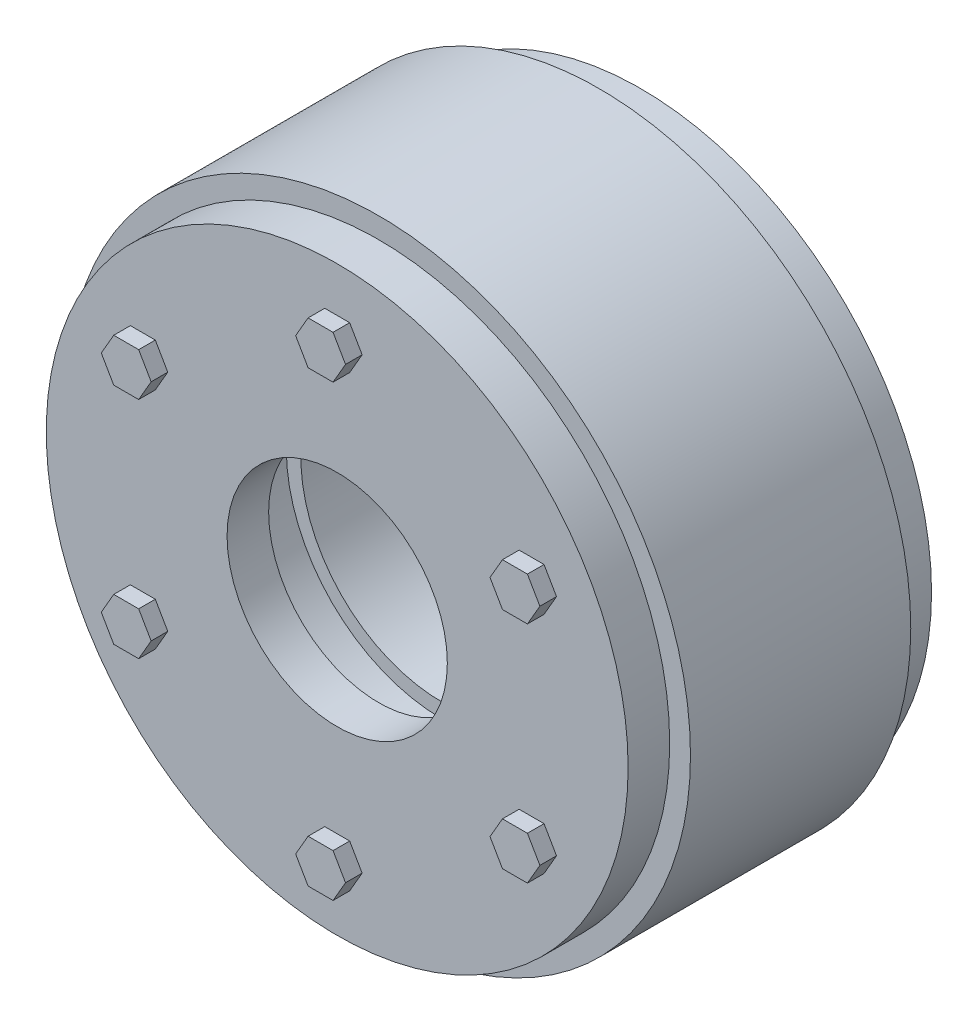
from build123d import *

# Parameters (mm, degrees)
SKETCH_2_R                    = 37.5
SKETCH_2_R_2                  = 34.5
EXTRUDE_1_DEPTH               = 3
SKETCH_3_R                    = 70
SKETCH_3_R_2                  = 26.5
EXTRUDE_2_DEPTH               = 10
EXTRUDE_3_DEPTH               = 4
PATTERN_CIRCULAR_1_COUNT      = 6
PATTERN_LINEAR_1_COUNT        = 2
PATTERN_LINEAR_1_PITCH        = 77
PATTERN_LINEAR_1_COPY_1_DEPTH = 4
PATTERN_LINEAR_1_COPY_2_DEPTH = 4
PATTERN_LINEAR_1_COPY_3_DEPTH = 4
PATTERN_LINEAR_1_COPY_4_DEPTH = 4
PATTERN_LINEAR_1_COPY_5_DEPTH = 4


with BuildPart() as part:
    # 草图1 → 旋转1 (revolve)
    with BuildSketch(Plane(origin=(0, 0, 0), x_dir=(1, 0, 0), z_dir=(0, 1, 0))):
        Polygon((37.5, 26.5), (37.5, 11.25), (34, 11.25), (34, -11.25), (37.5, -11.25), (37.5, -26.5), (75, -26.5), (75, 26.5), align=None)
    revolve(axis=Axis((0, 0, 1000), (0, 0, -1)))

    # 草图2 → 凸台-拉伸1 (add)
    with BuildSketch(Plane.XY.offset(26.5)):
        Circle(SKETCH_2_R)
        Circle(SKETCH_2_R_2, mode=Mode.SUBTRACT)
    extrude(amount=-EXTRUDE_1_DEPTH)

    # 草图3 → 凸台-拉伸2 (add)
    with BuildSketch(Plane.XY.offset(26.5)):
        Circle(SKETCH_3_R)
        Circle(SKETCH_3_R_2, mode=Mode.SUBTRACT)
    extrude(amount=EXTRUDE_2_DEPTH)

    # 草图4 → 旋转2 (revolve)
    with BuildSketch(Plane(origin=(0, 0, 0), x_dir=(0, 0, -1), z_dir=(1, 0, 0)), mode=Mode.PRIVATE) as revolve_2_sk:
        with BuildLine():
            Line((26.5, 37.5), (26.5, 70))
            Line((26.5, 70), (36.5, 70))
            Line((36.5, 70), (36.5, 45.642135624))
            ThreePointArc((36.5, 45.642135624), (37.417517095, 42.755384278), (39.833333333, 40.928090416))
            ThreePointArc((39.833333333, 40.928090416), (44.664965809, 37.273502692), (46.5, 31.5))
            Line((46.5, 31.5), (46.5, 18.5))
            Line((46.5, 18.5), (38.5, 18.5))
            Line((38.5, 18.5), (38.5, 24.5))
            ThreePointArc((38.5, 24.5), (35.571067812, 31.571067812), (28.5, 34.5))
            Line((28.5, 34.5), (24.5, 34.5))
            Line((24.5, 34.5), (24.5, 37.5))
            Line((24.5, 37.5), (26.5, 37.5))
        make_face()
    revolve(revolve_2_sk.sketch.rotate(Axis((0, 0, 1000), (0, 0, -1)), 90), axis=Axis((0, 0, 1000), (0, 0, -1)))

    # 草图5 → 凸台-拉伸3 (add)
    with BuildSketch(Plane.XY.offset(36.5)):
        Polygon((3, 48.803847577), (6, 54), (3, 59.196152423), (-3, 59.196152423), (-6, 54), (-3, 48.803847577), align=None)
    extrude_3 = extrude(amount=EXTRUDE_3_DEPTH)

    # 阵列(圆周)1: 凸台-拉伸3 ×6 about axis
    pattern_circular_1_axis = Axis((0, 0, 0), (0, 0, 1))
    for i in range(1, PATTERN_CIRCULAR_1_COUNT):
        add(extrude_3.rotate(pattern_circular_1_axis, i * 360 / PATTERN_CIRCULAR_1_COUNT))

    # 阵列(线性)1: 凸台-拉伸3 ×2
    with Locations(*[(0, 0, -i * PATTERN_LINEAR_1_PITCH) for i in range(1, PATTERN_LINEAR_1_COUNT)]):
        add(extrude_3)

    # 阵列(线性)1 copy 1 sketch → 阵列(线性)1 copy 1 (add)
    with BuildSketch(Plane(origin=(0, 0, -40.5), x_dir=(0.5000000000000001, 0.8660254037844386, 0), z_dir=(0, 0, 1))):
        Polygon((3, 48.803847577), (6, 54), (3, 59.196152423), (-3, 59.196152423), (-6, 54), (-3, 48.803847577), align=None)
    extrude(amount=PATTERN_LINEAR_1_COPY_1_DEPTH)

    # 阵列(线性)1 copy 2 sketch → 阵列(线性)1 copy 2 (add)
    with BuildSketch(Plane(origin=(0, 0, -40.5), x_dir=(-0.4999999999999998, 0.8660254037844387, 0), z_dir=(0, 0, 1))):
        Polygon((3, 48.803847577), (6, 54), (3, 59.196152423), (-3, 59.196152423), (-6, 54), (-3, 48.803847577), align=None)
    extrude(amount=PATTERN_LINEAR_1_COPY_2_DEPTH)

    # 阵列(线性)1 copy 3 sketch → 阵列(线性)1 copy 3 (add)
    with BuildSketch(Plane(origin=(0, 0, -40.5), x_dir=(-1, 0, 0), z_dir=(0, 0, 1))):
        Polygon((3, 48.803847577), (6, 54), (3, 59.196152423), (-3, 59.196152423), (-6, 54), (-3, 48.803847577), align=None)
    extrude(amount=PATTERN_LINEAR_1_COPY_3_DEPTH)

    # 阵列(线性)1 copy 4 sketch → 阵列(线性)1 copy 4 (add)
    with BuildSketch(Plane(origin=(0, 0, -40.5), x_dir=(-0.5000000000000004, -0.8660254037844384, 0), z_dir=(0, 0, 1))):
        Polygon((3, 48.803847577), (6, 54), (3, 59.196152423), (-3, 59.196152423), (-6, 54), (-3, 48.803847577), align=None)
    extrude(amount=PATTERN_LINEAR_1_COPY_4_DEPTH)

    # 阵列(线性)1 copy 5 sketch → 阵列(线性)1 copy 5 (add)
    with BuildSketch(Plane(origin=(0, 0, -40.5), x_dir=(0.5000000000000001, -0.8660254037844386, 0), z_dir=(0, 0, 1))):
        Polygon((3, 48.803847577), (6, 54), (3, 59.196152423), (-3, 59.196152423), (-6, 54), (-3, 48.803847577), align=None)
    extrude(amount=PATTERN_LINEAR_1_COPY_5_DEPTH)


solid = part.part
